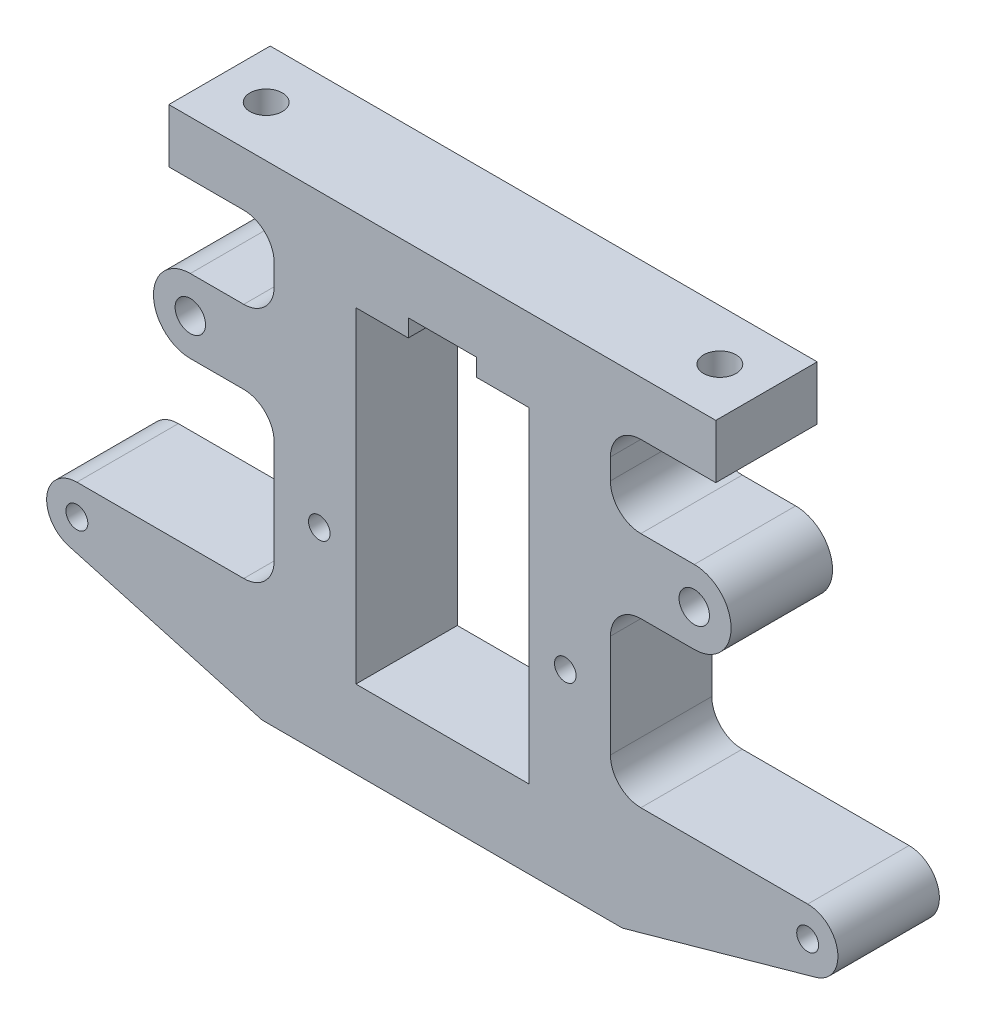
from build123d import *

# Parameters (mm, degrees)
SKETCH1_R          = 1.3716
SKETCH1_R_2        = 1.905
SKETCH1_W          = 21.654448346
SKETCH1_H          = 40.81550601
EXTRUDE1_DEPTH     = 6.35
SKETCH2_R          = 2.032
EXTRUDE2_DEPTH     = 12.7
SKETCH3_R          = 1.349669532
CUT_EXTRUDE1_DEPTH = 72.389643478
SKETCH4_W          = 8.536869312
SKETCH4_H          = 4.372972384
CUT_EXTRUDE2_DEPTH = 72.389643478


with BuildPart() as part:
    # Sketch1 → Extrude1 (new, symmetric)
    with BuildSketch(Plane.XY):
        with BuildLine():
            Line((22.563049012, -49.803089557), (46.777222737, -43.035560041))
            ThreePointArc((46.777222737, -43.035560041), (49.511252826, -38.871621578), (45.757317366, -35.59728613))
            Line((45.757317366, -35.59728613), (24.862986263, -35.59728613))
            ThreePointArc((24.862986263, -35.59728613), (22.168909426, -34.481362966), (21.052986263, -31.78728613))
            Line((21.052986263, -31.78728613), (21.052986263, -18.898003738))
            ThreePointArc((21.052986263, -18.898003738), (22.168909426, -16.203926902), (24.862986263, -15.088003738))
            Line((24.862986263, -15.088003738), (31.554570289, -15.088003738))
            ThreePointArc((31.554570289, -15.088003738), (36.166042792, -10.476531235), (31.554570289, -5.865058732))
            Line((31.554570289, -5.865058732), (24.862986263, -5.865058732))
            ThreePointArc((24.862986263, -5.865058732), (22.168909426, -4.749135569), (21.052986263, -2.055058732))
            Line((21.052986263, -2.055058732), (21.052986263, 0.541184861))
            ThreePointArc((21.052986263, 0.541184861), (22.168909426, 3.235261698), (24.862986263, 4.351184861))
            Line((24.862986263, 4.351184861), (34.251425283, 4.351184861))
            Line((34.251425283, 4.351184861), (34.251425283, 11.107663069))
            Line((34.251425283, 11.107663069), (-34.251425283, 11.107663069))
            Line((-34.251425283, 11.107663069), (-34.251425283, 4.351184861))
            Line((-34.251425283, 4.351184861), (-24.862986263, 4.351184861))
            ThreePointArc((-24.862986263, 4.351184861), (-22.168909426, 3.235261698), (-21.052986263, 0.541184861))
            Line((-21.052986263, 0.541184861), (-21.052986263, -2.055058732))
            ThreePointArc((-21.052986263, -2.055058732), (-22.168909426, -4.749135569), (-24.862986263, -5.865058732))
            Line((-24.862986263, -5.865058732), (-31.554570289, -5.865058732))
            ThreePointArc((-31.554570289, -5.865058732), (-36.166042792, -10.476531235), (-31.554570289, -15.088003738))
            Line((-31.554570289, -15.088003738), (-24.862986263, -15.088003738))
            ThreePointArc((-24.862986263, -15.088003738), (-22.168909426, -16.203926902), (-21.052986263, -18.898003738))
            Line((-21.052986263, -18.898003738), (-21.052986263, -31.78728613))
            ThreePointArc((-21.052986263, -31.78728613), (-22.168909426, -34.481362966), (-24.862986263, -35.59728613))
            Line((-24.862986263, -35.59728613), (-45.757317366, -35.59728613))
            ThreePointArc((-45.757317366, -35.59728613), (-49.511252826, -38.871621578), (-46.777222737, -43.035560041))
            Line((-46.777222737, -43.035560041), (-22.563049012, -49.803089557))
            Line((-22.563049012, -49.803089557), (22.563049012, -49.803089557))
        make_face()
        with Locations((45.757317366, -39.38634569)):
            Circle(SKETCH1_R, mode=Mode.SUBTRACT)
        with Locations((31.554570289, -10.476531235)):
            Circle(SKETCH1_R_2, mode=Mode.SUBTRACT)
        with Locations(Location((-31.554570289, -10.476531235, 0), (0, 0, 180))):
            Circle(SKETCH1_R_2, mode=Mode.SUBTRACT)
        with Locations(Location((-45.757317366, -39.38634569, 0), (0, 0, 180))):
            Circle(SKETCH1_R, mode=Mode.SUBTRACT)
        with Locations((0.010545216, -19.616016269)):
            Rectangle(SKETCH1_W, SKETCH1_H, mode=Mode.SUBTRACT)
    extrude(amount=EXTRUDE1_DEPTH, both=True)

    # Sketch2 → Extrude2 (cut)
    with BuildSketch(Plane(origin=(0, 11.107663069, 0), x_dir=(1, 0, 0), z_dir=(0, 1, 0))):
        with Locations(Location((28.407237147, 0, 0), (0, 0, 180))):
            Circle(SKETCH2_R)
        with Locations(Location((-28.407237147, 0, 0), (0, 0, 270))):
            Circle(SKETCH2_R)
    extrude(amount=-EXTRUDE2_DEPTH, mode=Mode.SUBTRACT)

    # Sketch3 → Cut-Extrude1 (cut, through all)
    with BuildSketch(Plane.XY.offset(6.35)):
        with Locations((-15.402624173, -25.342644934)):
            Circle(SKETCH3_R)
        with Locations(Location((15.402624173, -25.342644934, 0), (0, 0, 180))):
            Circle(SKETCH3_R)
    extrude(amount=-CUT_EXTRUDE1_DEPTH, mode=Mode.SUBTRACT)

    # Sketch4 → Cut-Extrude2 (cut, through all)
    with BuildSketch(Plane.XY.offset(6.35)):
        with Locations((0.010545216, 0.791736736)):
            Rectangle(SKETCH4_W, SKETCH4_H)
    extrude(amount=-CUT_EXTRUDE2_DEPTH, mode=Mode.SUBTRACT)


solid = part.part
